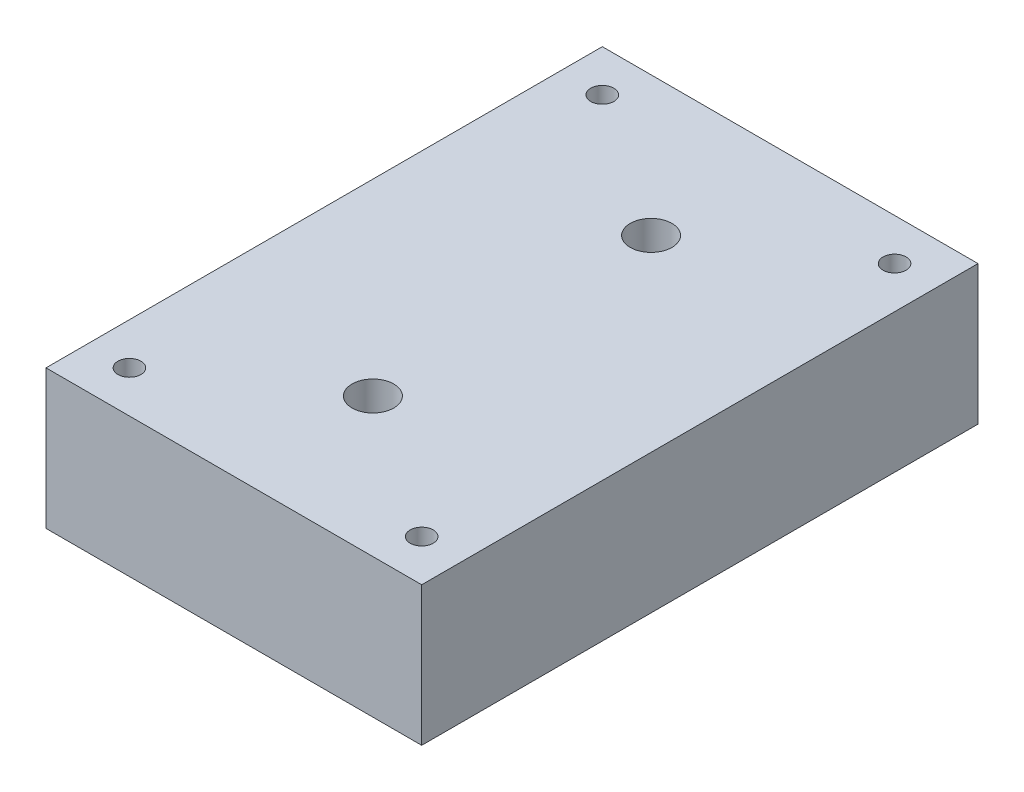
from build123d import *

# Parameters (mm, degrees)
SKIZZE1_W                                           = 135.069444444
SKIZZE1_H                                           = 50
AUFSATZ_LINEAR_AUSTRAGEN1_DEPTH                     = 200
STIRNSENKUNG_F_R_M8_SENKSCHRAUBE_KOPF_B_D           = 9
STIRNSENKUNG_F_R_M8_SENKSCHRAUBE_KOPF_B_CBORE_D     = 15
STIRNSENKUNG_F_R_M8_SENKSCHRAUBE_KOPF_B_CBORE_DEPTH = 34.5
STIRNSENKUNG_F_R_M8_SENKSCHRAUBE_KO_2_D             = 9
STIRNSENKUNG_F_R_M8_SENKSCHRAUBE_KO_2_DEPTH         = 50
STIRNSENKUNG_F_R_M8_SENKSCHRAUBE_KO_2_CBORE_D       = 15
STIRNSENKUNG_F_R_M8_SENKSCHRAUBE_KO_2_CBORE_DEPTH   = 6.5


with BuildPart() as part:
    # Skizze1 → Aufsatz-Linear austragen1 (new body)
    with BuildSketch(Plane.XY):
        Rectangle(SKIZZE1_W, SKIZZE1_H)
    extrude(amount=AUFSATZ_LINEAR_AUSTRAGEN1_DEPTH)

    # Stirnsenkung f_r M8 Senkschraube _Kopf B (through all)
    with Locations(Plane(origin=(0, 25, 0), x_dir=(1, 0, 0), z_dir=(0, 1, 0))):
        with Locations((0, -150)):
            stirnsenkung_f_r_m8_senkschraube_kopf_b = CounterBoreHole(STIRNSENKUNG_F_R_M8_SENKSCHRAUBE_KOPF_B_D / 2, STIRNSENKUNG_F_R_M8_SENKSCHRAUBE_KOPF_B_CBORE_D / 2, STIRNSENKUNG_F_R_M8_SENKSCHRAUBE_KOPF_B_CBORE_DEPTH)

    # Stirnsenkung f_r M8 Senkschraube _Ko 2
    with Locations(Plane(origin=(0, -25, 0), x_dir=(-1, 0, 0), z_dir=(0, -1, 0))):
        with Locations((0, -150)):
            stirnsenkung_f_r_m8_senkschraube_ko_2 = CounterBoreHole(STIRNSENKUNG_F_R_M8_SENKSCHRAUBE_KO_2_D / 2, STIRNSENKUNG_F_R_M8_SENKSCHRAUBE_KO_2_CBORE_D / 2, STIRNSENKUNG_F_R_M8_SENKSCHRAUBE_KO_2_CBORE_DEPTH, depth=STIRNSENKUNG_F_R_M8_SENKSCHRAUBE_KO_2_DEPTH)

    # Spiegeln1: Stirnsenkung f_r M8 Senkschraube _Kopf B, Stirnsenkung f_r M8 Senkschraube _Ko 2 across plane
    add(stirnsenkung_f_r_m8_senkschraube_kopf_b.mirror(Plane.XY.offset(100)), mode=Mode.SUBTRACT)
    add(stirnsenkung_f_r_m8_senkschraube_ko_2.mirror(Plane.XY.offset(100)), mode=Mode.SUBTRACT)

    # Skizze10 → Kernloch für M8 Helicoil1 (revolve, cut)
    with BuildSketch(Plane(origin=(-52.534722222, 25, 185), x_dir=(0, 0, 1), z_dir=(1, 0, 0))):
        Polygon((0, 0), (0, 32.493571569), (4.15, 30), (4.15, 0), align=None)
    kernloch_f_r_m8_helicoil1 = revolve(axis=Axis((-52.534722222, 31.35, 185), (0, -1, 0)), mode=Mode.SUBTRACT)

    # Spiegeln2: Kernloch für M8 Helicoil1 across plane
    add(kernloch_f_r_m8_helicoil1.mirror(Plane(origin=(0, 0, 0), x_dir=(0, 0, 1), z_dir=(1, 0, 0))), mode=Mode.SUBTRACT)

    # Spiegeln3: Kernloch für M8 Helicoil1 across plane
    add(kernloch_f_r_m8_helicoil1.mirror(Plane.XY.offset(100)), mode=Mode.SUBTRACT)

    # Spiegeln3 copy 1 sketch → Spiegeln3 copy 1 (revolve, cut)
    with BuildSketch(Plane(origin=(52.534722222, 25, 15), x_dir=(0, 0, -1), z_dir=(-1, 0, 0))):
        Polygon((0, 0), (0, 32.493571569), (4.15, 30), (4.15, 0), align=None)
    revolve(axis=Axis((52.534722222, 31.35, 15), (0, -1, 0)), mode=Mode.SUBTRACT)


solid = part.part
